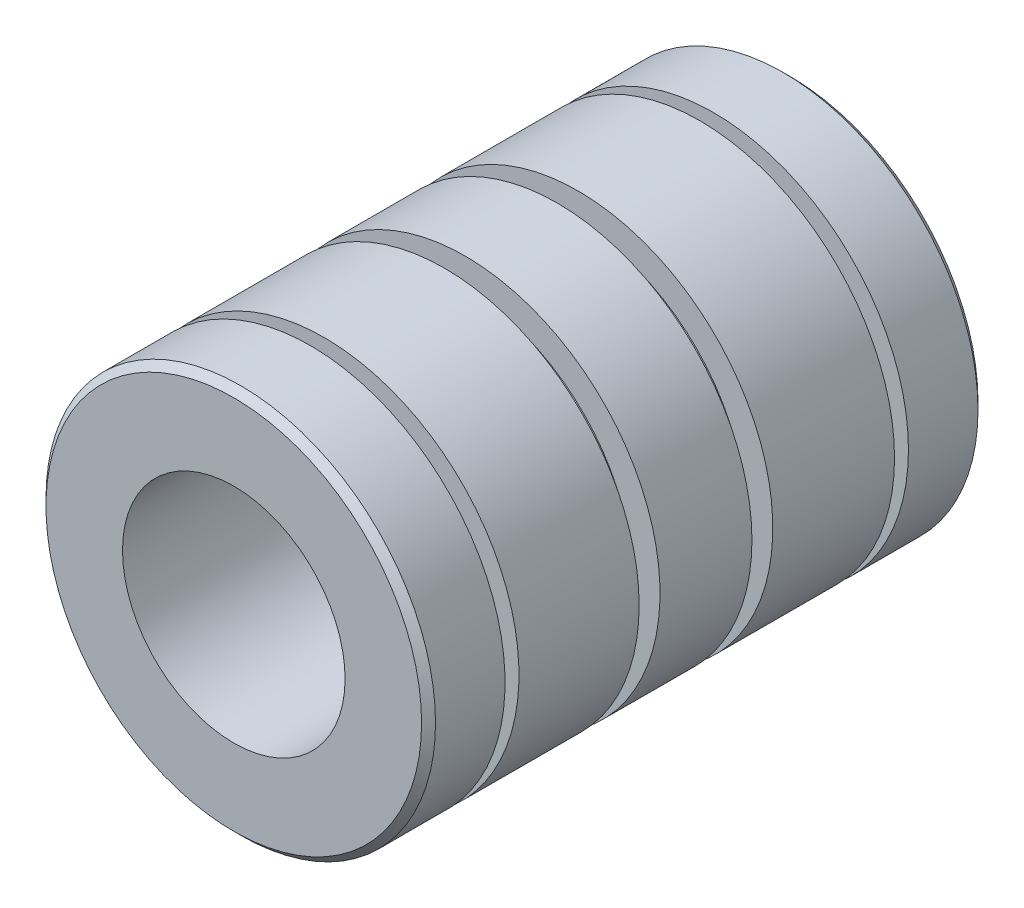
from build123d import *

# Parameters (mm, degrees)
SKETCH2_R           = 11.1125
BOSS_EXTRUDE1_DEPTH = 31.75
SKETCH3_R           = 6.35
CUT_EXTRUDE1_DEPTH  = 36.426512847
SKETCH4_W           = 3.175
SKETCH4_H           = 0.79375
CHAMFER1_SIZE       = 0.396875
SKETCH5_W           = 3.175
SKETCH5_H           = 1.190625


with BuildPart() as part:
    # Sketch2 → Boss-Extrude1 (new body)
    with BuildSketch(Plane.XY):
        Circle(SKETCH2_R)
    extrude(amount=BOSS_EXTRUDE1_DEPTH)

    # Sketch3 → Cut-Extrude1 (cut, through all)
    with BuildSketch(Plane.XY.offset(31.75)):
        Circle(SKETCH3_R)
    extrude(amount=-CUT_EXTRUDE1_DEPTH, mode=Mode.SUBTRACT)

    # Sketch4 → Cut-Revolve1 (revolve, cut)
    with BuildSketch(Plane(origin=(0, 0, 0), x_dir=(1, 0, 0), z_dir=(0, 1, 0))):
        with Locations((11.1125, -26.9875)):
            Rectangle(SKETCH4_W, SKETCH4_H)
        with Locations((11.1125, -4.7625)):
            Rectangle(SKETCH4_W, SKETCH4_H)
    revolve(axis=Axis((0, 0, 31.75), (0, 0, -1)), mode=Mode.SUBTRACT)

    # Chamfer1
    chamfer1_edges = [part.edges().sort_by_distance(p)[0] for p in [
        (-11.1125, 0, 0),
        (-11.1125, 0, 31.75),
    ]]
    chamfer(chamfer1_edges, length=CHAMFER1_SIZE)

    # Sketch5 → Cut-Revolve2 (revolve, cut)
    with BuildSketch(Plane(origin=(0, 0, 0), x_dir=(1, 0, 0), z_dir=(0, 1, 0)), mode=Mode.PRIVATE) as cut_revolve2_sk:
        with Locations((11.1125, -12.7)):
            Rectangle(SKETCH5_W, SKETCH5_H)
        with Locations((11.1125, -19.137777624)):
            Rectangle(SKETCH5_W, SKETCH5_H)
    revolve(cut_revolve2_sk.sketch.rotate(Axis((0, 0, 31.75), (0, 0, -1)), 180), axis=Axis((0, 0, 31.75), (0, 0, -1)), mode=Mode.SUBTRACT)


solid = part.part
